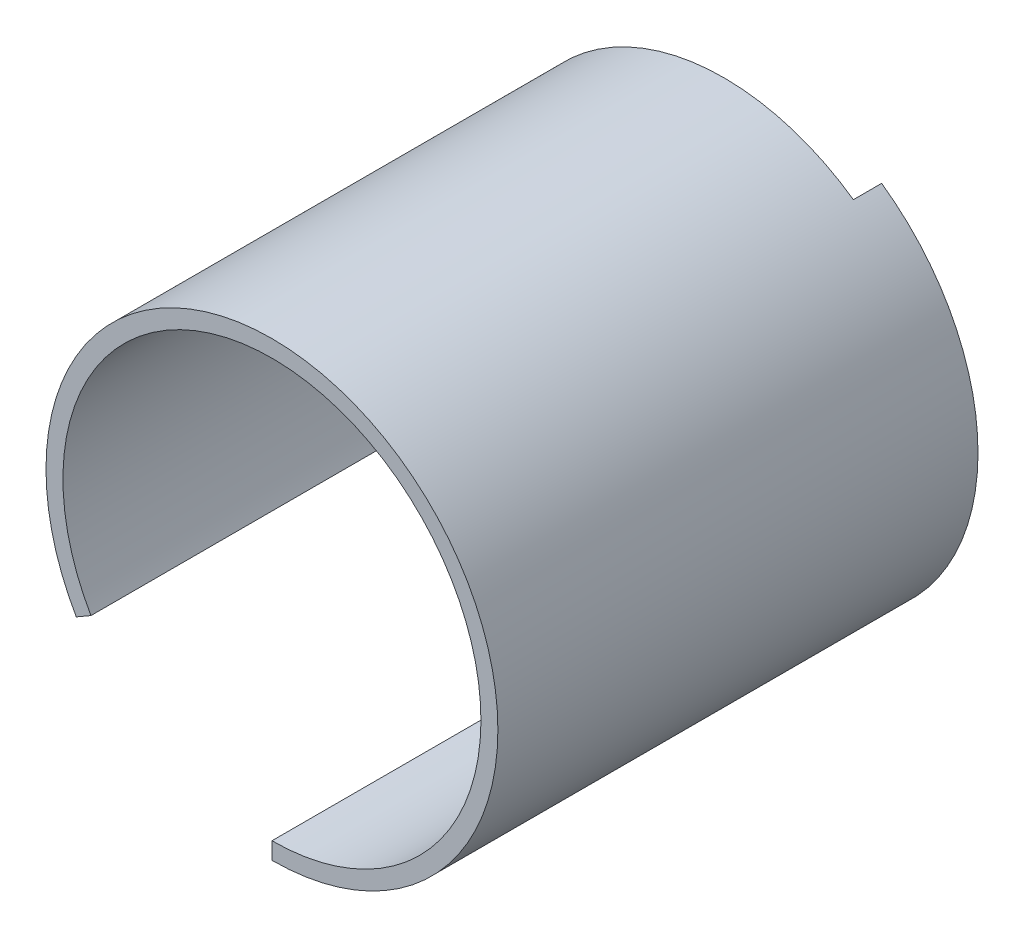
from build123d import *

# Parameters (mm, degrees)
EXTRUDE_1_DEPTH = 80
EXTRUDE_START   = 5
EXTRUDE_2_DEPTH = 5


with BuildPart() as part:
    # 草圖1 → 填料-伸長1 (new body)
    with BuildSketch(Plane.XY):
        with BuildLine():
            Line((0, -37), (0, -40))
            ThreePointArc((0, -40), (20, 34.641016151), (-34.641016151, -20))
            Line((-34.641016151, -20), (-32.04293994, -18.5))
            ThreePointArc((-32.04293994, -18.5), (18.5, 32.04293994), (0, -37))
        make_face()
    extrude(amount=EXTRUDE_1_DEPTH)

    # 草圖2 → 填料-伸長2 (add)
    with BuildSketch(Plane(origin=(0, 0, 0), x_dir=(-1, 0, 0), z_dir=(0, 0, -1)).offset(EXTRUDE_START)):
        with BuildLine():
            Line((0, -30), (0, -40))
            ThreePointArc((0, -40), (-38.14867803, -12.02823198), (-22.943057454, 32.766081772))
            Line((-22.943057454, 32.766081772), (-17.207293091, 24.574561329))
            ThreePointArc((-17.207293091, 24.574561329), (-28.611508522, -9.021173985), (0, -30))
        make_face()
    extrude(amount=-EXTRUDE_2_DEPTH)


solid = part.part
